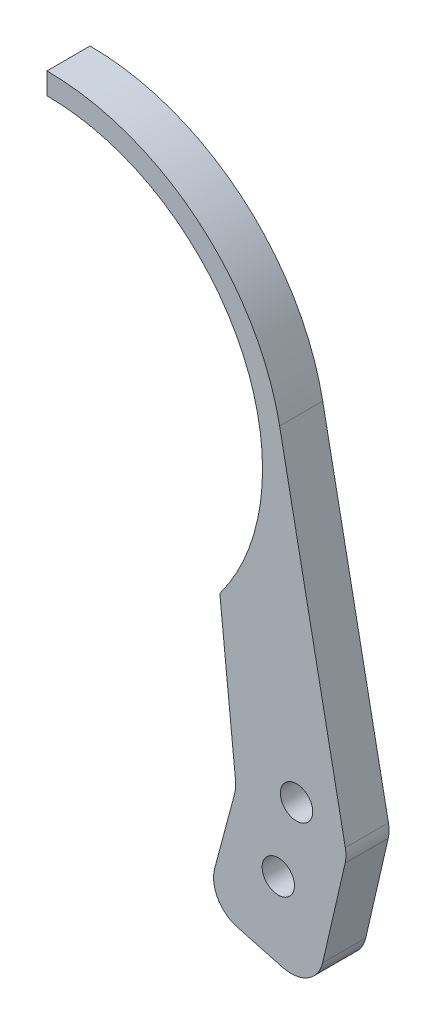
from build123d import *

# Parameters (mm, degrees)
SKETCH_1_R      = 1.5
EXTRUDE_1_DEPTH = 4
FILLET_1_R      = 3


with BuildPart() as part:
    # 草图1 → 凸台-拉伸1 (new body)
    with BuildSketch(Plane.XY):
        with BuildLine():
            Line((-10.940603829, 79.049047398), (-10.940603829, 81.049047398))
            ThreePointArc((-10.940603829, 81.049047398), (3.025840458, 76.047236536), (10.641601769, 63.316177759))
            Line((10.641601769, 63.316177759), (16.862252241, 31.85349767))
            Line((16.862252241, 31.85349767), (13.93581935, 19.153521371))
            Line((13.93581935, 19.153521371), (3.838956556, 21.858772904))
            Line((3.838956556, 21.858772904), (6.612464071, 32.210388823))
            Line((6.612464071, 32.210388823), (5.095703598, 47.097610493))
            ThreePointArc((5.095703598, 47.097610493), (6.934361039, 68.020425829), (-10.940603829, 79.049047398))
        make_face()
        with Locations((10.520263625, 27.067195715)):
            Circle(SKETCH_1_R, mode=Mode.SUBTRACT)
        with Locations((12.212445248, 33.85958273)):
            Circle(SKETCH_1_R, mode=Mode.SUBTRACT)
    extrude(amount=EXTRUDE_1_DEPTH)

    # 圆角1
    fillet_1_edges = [part.edges().sort_by_distance(p)[0] for p in [
        (16.862252241, 31.85349767, 2),
        (13.93581935, 19.153521371, 2),
        (3.838956556, 21.858772904, 2),
        (6.612464071, 32.210388823, 2),
    ]]
    fillet(fillet_1_edges, radius=FILLET_1_R)


solid = part.part
